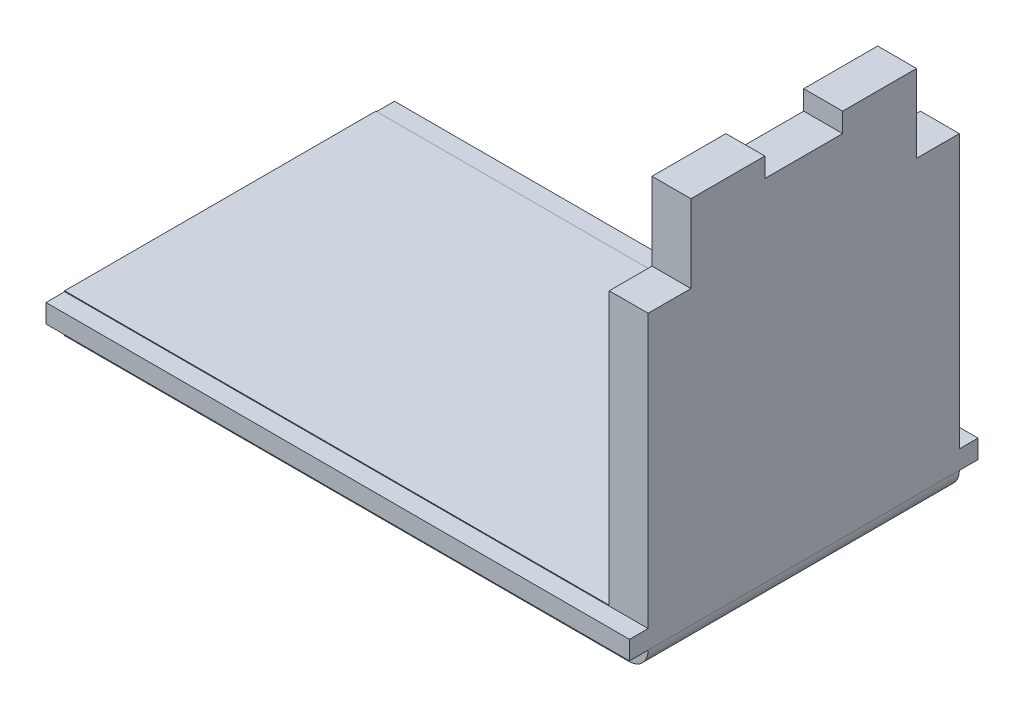
from build123d import *

# Parameters (mm, degrees)
BOSS_EXTRUDE1_DEPTH = 80
SKETCH2_W           = 4.8
SKETCH2_H           = 4.8
BOSS_EXTRUDE2_DEPTH = 150
SKETCH3_W           = 11
SKETCH3_H           = 20
CUT_EXTRUDE1_DEPTH  = 200.226102707
FILLET1_R           = 5


with BuildPart() as part:
    # Sketch1 → Boss-Extrude1 (new body)
    with BuildSketch(Plane.XY):
        Polygon((-80, 0), (70, 0), (70, 100), (60, 100), (60, 10), (-80, 10), align=None)
    extrude(amount=BOSS_EXTRUDE1_DEPTH)

    # Sketch2 → Boss-Extrude2 (add)
    with BuildSketch(Plane(origin=(70, 0, 0), x_dir=(0, 0, -1), z_dir=(1, 0, 0))):
        with Locations((-82.4, 7.4)):
            Rectangle(SKETCH2_W, SKETCH2_H)
        with Locations((2.4, 7.4)):
            Rectangle(SKETCH2_W, SKETCH2_H)
    extrude(amount=-BOSS_EXTRUDE2_DEPTH)

    # Sketch3 → Cut-Extrude1 (cut, through all)
    with BuildSketch(Plane(origin=(70, 0, 0), x_dir=(0, 0, -1), z_dir=(1, 0, 0))):
        Polygon((-40, 100), (-50, 100), (-50, 95), (-30, 95), (-30, 100), align=None)
        with Locations((-74.5, 90)):
            Rectangle(SKETCH3_W, SKETCH3_H)
        with Locations((-5.5, 90)):
            Rectangle(SKETCH3_W, SKETCH3_H)
    extrude(amount=-CUT_EXTRUDE1_DEPTH, mode=Mode.SUBTRACT)

    # Fillet1
    fillet1_edges = [part.edges().sort_by_distance(p)[0] for p in [
        (70, 0, 40),
    ]]
    fillet(fillet1_edges, radius=FILLET1_R)


solid = part.part
